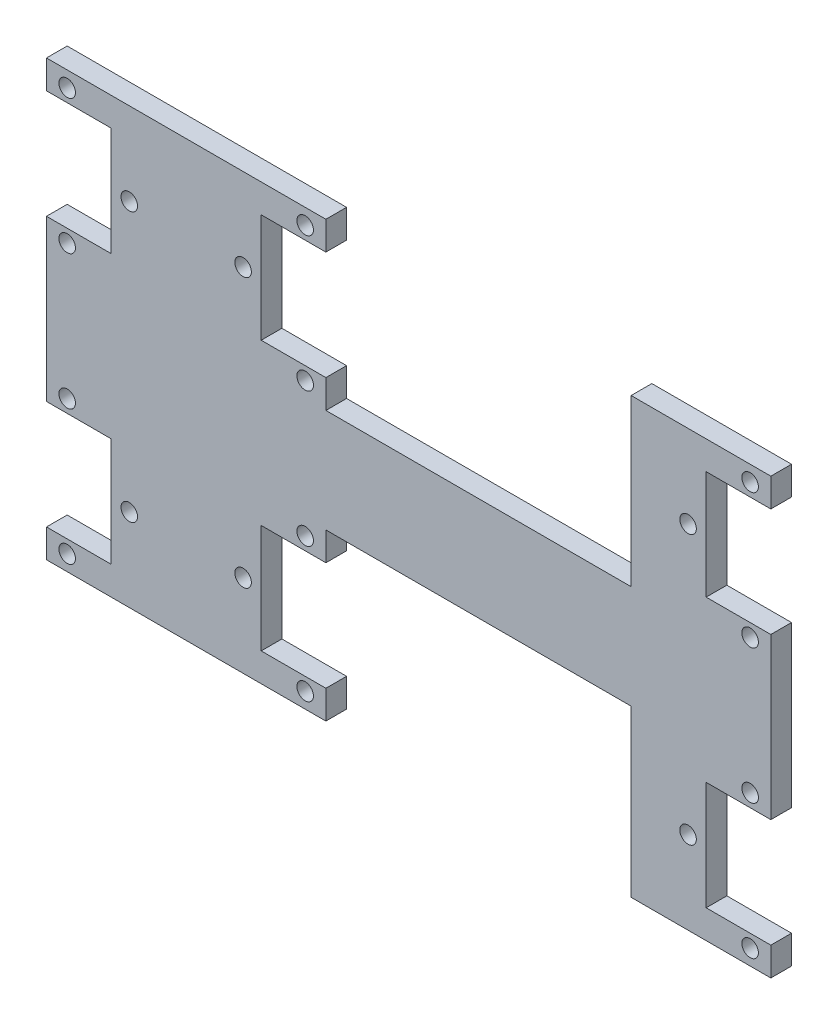
from build123d import *

# Parameters (mm, degrees)
SKETCH_3_R      = 1.6
EXTRUDE_2_DEPTH = 4


with BuildPart() as part:
    # Эскиз3 → Бобышка-Вытянуть2 (new body)
    # profile 1 of 6: a face of its own
    with BuildSketch(Plane.XY):
        Polygon((-16, -10), (-70, -10), (-70, -15.5), (-57.5, -15.5), (-57.5, -36.5), (-70, -36.5), (-70, -42), (-16, -42), (-16, -36.5), (-28.5, -36.5), (-28.5, -15.5), (-16, -15.5), align=None)
        with Locations((-66, -39)):
            Circle(SKETCH_3_R, mode=Mode.SUBTRACT)
        with Locations((-54, -26)):
            Circle(SKETCH_3_R, mode=Mode.SUBTRACT)
        with Locations((-20, -39)):
            Circle(SKETCH_3_R, mode=Mode.SUBTRACT)
        with Locations((-32, -26)):
            Circle(SKETCH_3_R, mode=Mode.SUBTRACT)
        with Locations((-66, -13)):
            Circle(SKETCH_3_R, mode=Mode.SUBTRACT)
        with Locations((-20, -13)):
            Circle(SKETCH_3_R, mode=Mode.SUBTRACT)
    # profile 2 of 6: a face of its own
    with BuildSketch(Plane.XY):
        Polygon((70, -10), (43, -10), (43, -42), (70, -42), (70, -36.5), (57.5, -36.5), (57.5, -15.5), (70, -15.5), align=None)
        with Locations((66, -39)):
            Circle(SKETCH_3_R, mode=Mode.SUBTRACT)
        with Locations((54, -26)):
            Circle(SKETCH_3_R, mode=Mode.SUBTRACT)
        with Locations((66, -13)):
            Circle(SKETCH_3_R, mode=Mode.SUBTRACT)
    # profile 3 of 6: a face of its own
    with BuildSketch(Plane.XY):
        Polygon((-70, 10), (-70, -10), (-16, -10), (43, -10), (70, -10), (70, 10), (43, 10), (-16, 10), (-43, 10), align=None)
    # profile 4 of 6: a face of its own
    with BuildSketch(Plane.XY):
        Polygon((-43, 42), (-43, 10), (-16, 10), (-16, 15.5), (-28.5, 15.5), (-28.5, 36.5), (-16, 36.5), (-16, 42), align=None)
        with Locations((-20, 13)):
            Circle(SKETCH_3_R, mode=Mode.SUBTRACT)
        with Locations((-32, 26)):
            Circle(SKETCH_3_R, mode=Mode.SUBTRACT)
        with Locations((-20, 39)):
            Circle(SKETCH_3_R, mode=Mode.SUBTRACT)
    # profile 5 of 6: a face of its own
    with BuildSketch(Plane.XY):
        Polygon((-70, 15.5), (-70, 10), (-43, 10), (-43, 42), (-70, 42), (-70, 36.5), (-57.5, 36.5), (-57.5, 15.5), align=None)
        with Locations((-66, 13)):
            Circle(SKETCH_3_R, mode=Mode.SUBTRACT)
        with Locations((-54, 26)):
            Circle(SKETCH_3_R, mode=Mode.SUBTRACT)
        with Locations((-66, 39)):
            Circle(SKETCH_3_R, mode=Mode.SUBTRACT)
    # profile 6 of 6: a face of its own
    with BuildSketch(Plane.XY):
        Polygon((43, 10), (70, 10), (70, 15.5), (57.5, 15.5), (57.5, 36.5), (70, 36.5), (70, 42), (43, 42), align=None)
        with Locations((66, 13)):
            Circle(SKETCH_3_R, mode=Mode.SUBTRACT)
        with Locations((54, 26)):
            Circle(SKETCH_3_R, mode=Mode.SUBTRACT)
        with Locations((66, 39)):
            Circle(SKETCH_3_R, mode=Mode.SUBTRACT)
    extrude(amount=EXTRUDE_2_DEPTH)


solid = part.part
